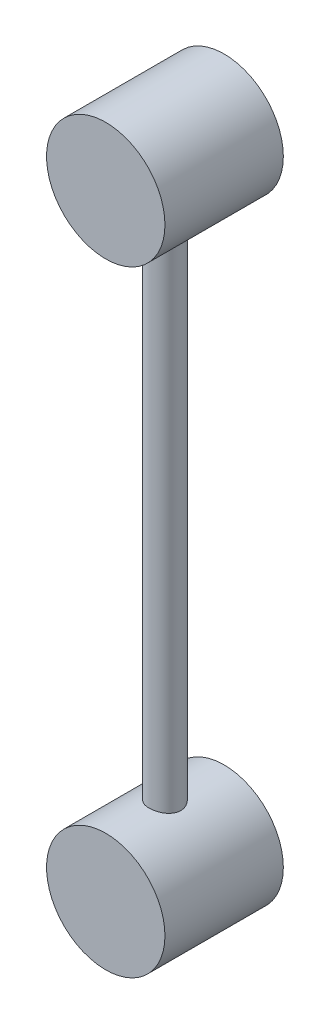
from build123d import *

# Parameters (mm, degrees)
SKETCH2_R           = 7.5
BOSS_EXTRUDE1_DEPTH = 7.5
SKETCH4_R           = 2
BOSS_EXTRUDE2_DEPTH = 78
LPATTERN1_COUNT     = 2
LPATTERN1_PITCH     = 78


with BuildPart() as part:
    # Sketch2 → Boss-Extrude1 (new, symmetric)
    with BuildSketch(Plane.XY):
        Circle(SKETCH2_R)
    boss_extrude1 = extrude(amount=BOSS_EXTRUDE1_DEPTH, both=True)

    # Sketch4 → Boss-Extrude2 (add)
    with BuildSketch(Plane(origin=(0, 0, 0), x_dir=(1, 0, 0), z_dir=(0, 1, 0))):
        with Locations(Location((0, 0, 0), (0, 0, 90))):
            Circle(SKETCH4_R)
    extrude(amount=BOSS_EXTRUDE2_DEPTH)

    # LPattern1: Boss-Extrude1 ×2
    with Locations(*[(0, i * LPATTERN1_PITCH, 0) for i in range(1, LPATTERN1_COUNT)]):
        add(boss_extrude1)


solid = part.part
